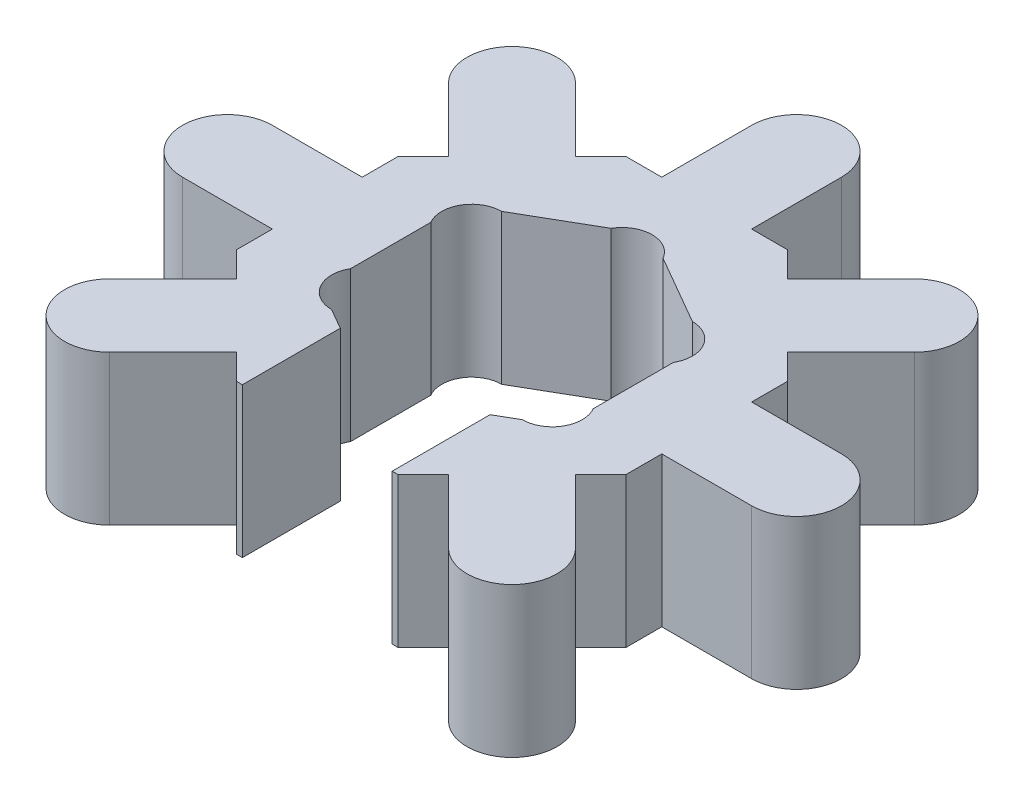
from build123d import *

# Parameters (mm, degrees)
EXTRUDE_2_DEPTH          = 5
CUT_EXTRUDE_1_DEPTH      = 5
SKETCH_5_R               = 1
CUT_EXTRUDE_2_DEPTH      = 5
PATTERN_CIRCULAR_1_COUNT = 6
CUT_EXTRUDE_3_DEPTH      = 10
EXTRUDE_3_DEPTH          = 5


with BuildPart() as part:
    # 스케치3 → 보스-돌출2 (new body)
    with BuildSketch(Plane(origin=(0, 0, 0), x_dir=(1, 0, 0), z_dir=(0, 1, 0))):
        Polygon((2.692388155, 6.5), (-2.692388155, 6.5), (-6.5, 2.692388155), (-6.5, -2.692388155), (-2.692388155, -6.5), (2.692388155, -6.5), (6.5, -2.692388155), (6.5, 2.692388155), align=None)
    extrude(amount=EXTRUDE_2_DEPTH)

    # 스케치4 → 컷-돌출1 (cut)
    with BuildSketch(Plane(origin=(0, 5, 0), x_dir=(1, 0, 0), z_dir=(0, 1, 0))):
        Polygon((4.05, 2.33826859), (0, 4.67653718), (-4.05, 2.33826859), (-4.05, -2.33826859), (0, -4.67653718), (4.05, -2.33826859), align=None)
    extrude(amount=-CUT_EXTRUDE_1_DEPTH, mode=Mode.SUBTRACT)

    # 스케치5 → 컷-돌출2 (cut)
    with BuildSketch(Plane(origin=(0, 5, 0), x_dir=(1, 0, 0), z_dir=(0, 1, 0))):
        with Locations((0, 3.67653718)):
            Circle(SKETCH_5_R)
    cut_extrude_2 = extrude(amount=-CUT_EXTRUDE_2_DEPTH, mode=Mode.SUBTRACT)

    # 원형 패턴1: 컷-돌출2 ×6 about axis
    pattern_circular_1_axis = Axis((0, 0, 0), (0, 1, 0))
    for i in range(1, PATTERN_CIRCULAR_1_COUNT):
        add(cut_extrude_2.rotate(pattern_circular_1_axis, i * 360 / PATTERN_CIRCULAR_1_COUNT), mode=Mode.SUBTRACT)

    # 스케치8 → 컷-돌출3 (cut)
    with BuildSketch(Plane(origin=(0, 5, 0), x_dir=(1, 0, 0), z_dir=(0, 1, 0))):
        with BuildLine():
            Line((2.5, 0), (2.5, -9.615491692))
            ThreePointArc((2.5, -9.615491692), (0, -12.115491692), (-2.5, -9.615491692))
            Line((-2.5, -9.615491692), (-2.5, 0))
            ThreePointArc((-2.5, 0), (0, 2.5), (2.5, 0))
        make_face()
    extrude(amount=-CUT_EXTRUDE_3_DEPTH, mode=Mode.SUBTRACT)

    # 스케치10 → 보스-돌출3 (add)
    with BuildSketch(Plane(origin=(0, 5, 0), x_dir=(1, 0, 0), z_dir=(0, 1, 0))):
        with BuildLine():
            Line((-3.535533906, -5.656854249), (-5.656854249, -7.778174593))
            ThreePointArc((-5.656854249, -7.778174593), (-7.778174593, -7.778174593), (-7.778174593, -5.656854249))
            Line((-7.778174593, -5.656854249), (-5.656854249, -3.535533906))
            ThreePointArc((-5.656854249, -3.535533906), (-3.535533906, -3.535533906), (-3.535533906, -5.656854249))
        make_face()
        with BuildLine():
            Line((-6.5, -1.5), (-9.5, -1.5))
            ThreePointArc((-9.5, -1.5), (-11, 0), (-9.5, 1.5))
            Line((-9.5, 1.5), (-6.5, 1.5))
            ThreePointArc((-6.5, 1.5), (-5, 0), (-6.5, -1.5))
        make_face()
        with BuildLine():
            Line((-5.656854249, 3.535533906), (-7.778174593, 5.656854249))
            ThreePointArc((-7.778174593, 5.656854249), (-7.778174593, 7.778174593), (-5.656854249, 7.778174593))
            Line((-5.656854249, 7.778174593), (-3.535533906, 5.656854249))
            ThreePointArc((-3.535533906, 5.656854249), (-3.535533906, 3.535533906), (-5.656854249, 3.535533906))
        make_face()
        with BuildLine():
            Line((-1.5, 6.5), (-1.5, 9.5))
            ThreePointArc((-1.5, 9.5), (0, 11), (1.5, 9.5))
            Line((1.5, 9.5), (1.5, 6.5))
            ThreePointArc((1.5, 6.5), (0, 5), (-1.5, 6.5))
        make_face()
        with BuildLine():
            Line((3.535533906, 5.656854249), (5.656854249, 7.778174593))
            ThreePointArc((5.656854249, 7.778174593), (7.778174593, 7.778174593), (7.778174593, 5.656854249))
            Line((7.778174593, 5.656854249), (5.656854249, 3.535533906))
            ThreePointArc((5.656854249, 3.535533906), (3.535533906, 3.535533906), (3.535533906, 5.656854249))
        make_face()
        with BuildLine():
            Line((6.5, 1.5), (9.5, 1.5))
            ThreePointArc((9.5, 1.5), (11, 0), (9.5, -1.5))
            Line((9.5, -1.5), (6.5, -1.5))
            ThreePointArc((6.5, -1.5), (5, 0), (6.5, 1.5))
        make_face()
        with BuildLine():
            Line((5.656854249, -3.535533906), (7.778174593, -5.656854249))
            ThreePointArc((7.778174593, -5.656854249), (7.778174593, -7.778174593), (5.656854249, -7.778174593))
            Line((5.656854249, -7.778174593), (3.535533906, -5.656854249))
            ThreePointArc((3.535533906, -5.656854249), (3.535533906, -3.535533906), (5.656854249, -3.535533906))
        make_face()
    extrude(amount=-EXTRUDE_3_DEPTH)


solid = part.part
